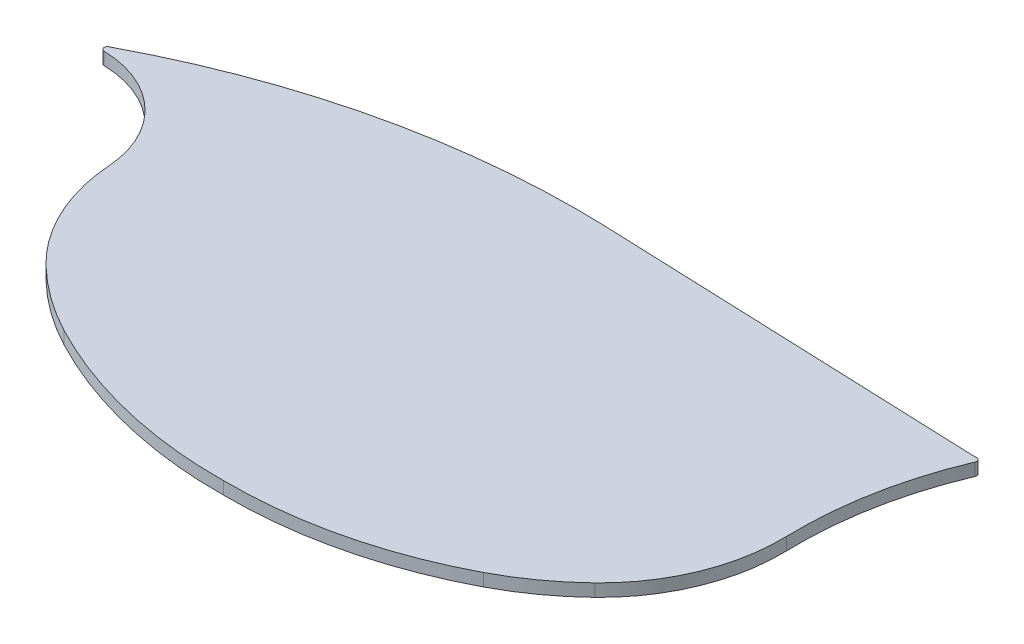
from build123d import *

# Parameters (mm, degrees)
BOSS_EXTRUDE1_DEPTH = 3


with BuildPart() as part:
    # Sketch1 → Boss-Extrude1 (new body)
    with BuildSketch(Plane(origin=(0, 0, 0), x_dir=(1, 0, 0), z_dir=(0, 1, 0))):
        with BuildLine():
            Line((125.334448741, 60.70559707), (34.689006477, 64.197109776))
            ThreePointArc((34.689006477, 64.197109776), (-15.13644212, 59.561512619), (-62.05150383, 42.153437665))
            ThreePointArc((-62.05150383, 42.153437665), (-62.647956965, 41.28649391), (-61.869388221, 40.578554275))
            ThreePointArc((-61.869388221, 40.578554275), (-45.258927275, 33.746363612), (-37.601267241, 17.499933699))
            ThreePointArc((-37.601267241, 17.499933699), (-33.623817753, 2.15297615), (-24.412676642, -10.750670229))
            ThreePointArc((-24.412676642, -10.750670229), (-17.089531788, -16.87593356), (-8.972231882, -21.901542344))
            ThreePointArc((-8.972231882, -21.901542344), (15.331470951, -31.037864787), (41.132426556, -33.945277559))
            ThreePointArc((41.132426556, -33.945277559), (66.933382162, -31.037864787), (91.237084995, -21.901542344))
            ThreePointArc((91.237084995, -21.901542344), (99.354384901, -16.87593356), (106.677529755, -10.750670229))
            ThreePointArc((106.677529755, -10.750670229), (116.726166056, 4.084607563), (119.930653965, 21.713896145))
            ThreePointArc((119.930653965, 21.713896145), (121.458201516, 41.048643152), (127.049993776, 59.620064816))
            ThreePointArc((127.049993776, 59.620064816), (126.959504732, 60.402154552), (126.242784377, 60.727983579))
            ThreePointArc((126.242784377, 60.727983579), (125.788970047, 60.70244749), (125.334448741, 60.70559707))
        make_face()
    extrude(amount=BOSS_EXTRUDE1_DEPTH)


solid = part.part
